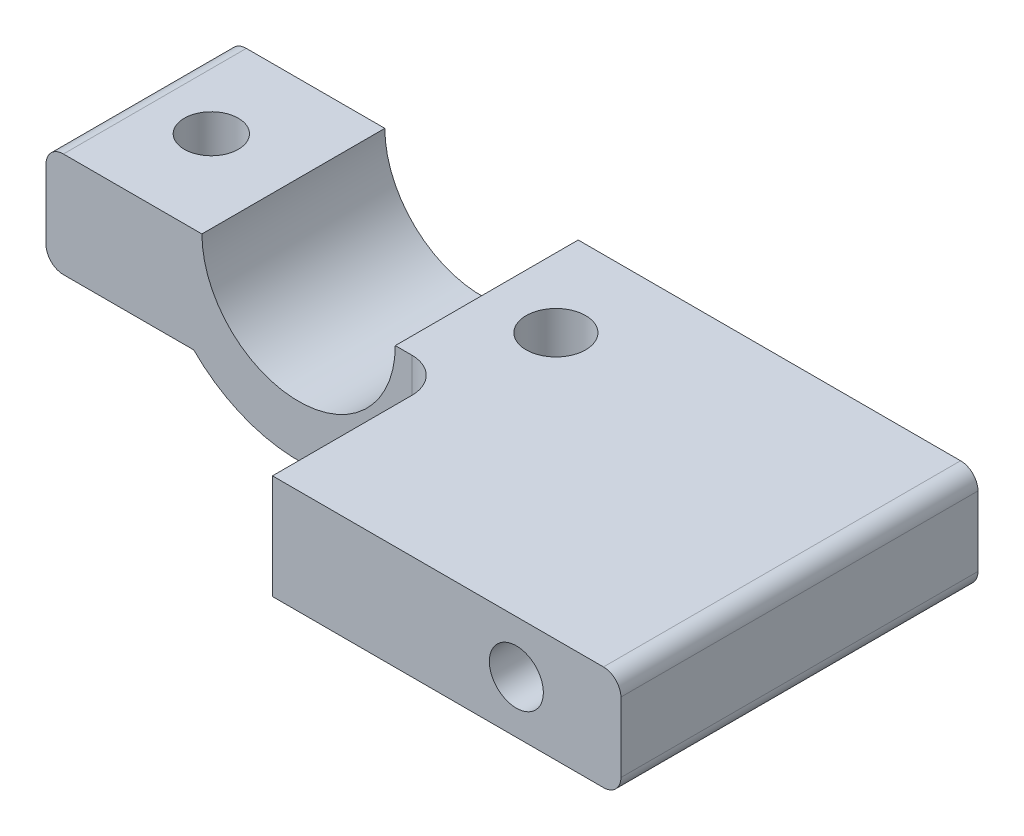
from build123d import *

# Parameters (mm, degrees)
EXTRUDE_1_DEPTH     = 10.5
SKETCH_2_R          = 1.55
CUT_EXTRUDE_1_DEPTH = 31.959651161
SKETCH_3_R          = 1.70728631
CUT_EXTRUDE_2_DEPTH = 31.959651161
SKETCH_5_W          = 20
SKETCH_5_H          = 6
EXTRUDE_2_DEPTH     = 10
SKETCH_6_R          = 1.55
CUT_EXTRUDE_4_DEPTH = 10
FILLET_1_R          = 2
FILLET_2_R          = 1


with BuildPart() as part:
    # 草图1 → 凸台-拉伸1 (new body)
    with BuildSketch(Plane.XY):
        with BuildLine():
            ThreePointArc((-6.020797289, -6), (-7.855786942, -3.246014713), (-8.5, 0))
            Line((-8.5, 0), (-14.5, 0))
            Line((-14.5, 0), (-14.5, -6))
            Line((-14.5, -6), (-6.020797289, -6))
        make_face()
        with BuildLine():
            Line((-8.5, 0), (-5.55, 0))
            ThreePointArc((-5.55, 0), (0, -5.55), (5.55, 0))
            Line((5.55, 0), (8.5, 0))
            ThreePointArc((8.5, 0), (0, -8.5), (-8.5, 0))
        make_face()
        with BuildLine():
            ThreePointArc((8.5, 0), (7.855786942, -3.246014713), (6.020797289, -6))
            Line((6.020797289, -6), (28.5, -6))
            Line((28.5, -6), (28.5, 0))
            Line((28.5, 0), (8.5, 0))
        make_face()
    extrude(amount=EXTRUDE_1_DEPTH)

    # 草图2 → 切除-拉伸1 (cut, through all)
    with BuildSketch(Plane.XZ.offset(6)):
        with Locations(Location((-10.260398645, 5.25, 0), (0, 0, 270))):
            Circle(SKETCH_2_R)
    extrude(amount=-CUT_EXTRUDE_1_DEPTH, mode=Mode.SUBTRACT)

    # 草图3 → 切除-拉伸2 (cut, through all)
    with BuildSketch(Plane.XZ.offset(6)):
        with Locations((9.520797289, 5.25)):
            Circle(SKETCH_3_R)
    extrude(amount=-CUT_EXTRUDE_2_DEPTH, mode=Mode.SUBTRACT)

    # 草图5 → 凸台-拉伸2 (add)
    with BuildSketch(Plane.XY.offset(10.5)):
        with Locations((18.5, -3)):
            Rectangle(SKETCH_5_W, SKETCH_5_H)
    extrude(amount=EXTRUDE_2_DEPTH)

    # 草图6 → 切除-拉伸4 (cut)
    with BuildSketch(Plane.XY.offset(20.5)):
        with Locations((22.5, -3)):
            Circle(SKETCH_6_R)
    extrude(amount=-CUT_EXTRUDE_4_DEPTH, mode=Mode.SUBTRACT)

    # 圆角1
    fillet_1_edges = [part.edges().sort_by_distance(p)[0] for p in [
        (8.5, -3, 10.5),
    ]]
    fillet(fillet_1_edges, radius=FILLET_1_R)

    # 圆角2
    fillet_2_edges = [part.edges().sort_by_distance(p)[0] for p in [
        (-14.5, -6, 5.25),
        (-14.5, 0, 5.25),
        (28.5, 0, 10.25),
        (28.5, -6, 10.25),
    ]]
    fillet(fillet_2_edges, radius=FILLET_2_R)


solid = part.part
